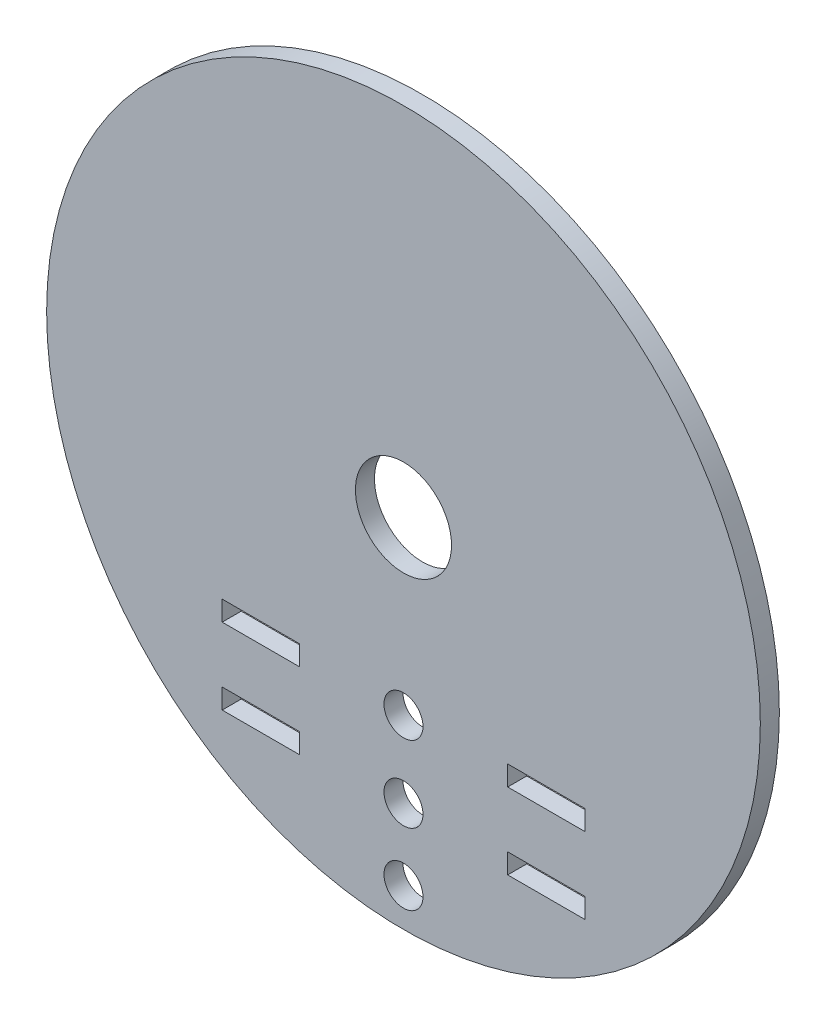
from build123d import *

# Parameters (mm, degrees)
SKETCH_1_R      = 37.5
SKETCH_1_R_2    = 2.05
SKETCH_1_R_3    = 5.05
SKETCH_1_W      = 8.1
SKETCH_1_H      = 2.1
EXTRUDE_1_DEPTH = 2


with BuildPart() as part:
    # 草图1 → 凸台-拉伸1 (new body)
    with BuildSketch(Plane.XY):
        with Locations((0, 26)):
            Circle(SKETCH_1_R)
        Circle(SKETCH_1_R_2, mode=Mode.SUBTRACT)
        with Locations((0, 8)):
            Circle(SKETCH_1_R_2, mode=Mode.SUBTRACT)
        with Locations((0, 26)):
            Circle(SKETCH_1_R_3, mode=Mode.SUBTRACT)
        with Locations((0, -7.5)):
            Circle(SKETCH_1_R_2, mode=Mode.SUBTRACT)
        with Locations((-15, 8)):
            Rectangle(SKETCH_1_W, SKETCH_1_H, mode=Mode.SUBTRACT)
        with Locations((-15, 0)):
            Rectangle(SKETCH_1_W, SKETCH_1_H, mode=Mode.SUBTRACT)
        with Locations((15, 8)):
            Rectangle(SKETCH_1_W, SKETCH_1_H, mode=Mode.SUBTRACT)
        with Locations((15, 0)):
            Rectangle(SKETCH_1_W, SKETCH_1_H, mode=Mode.SUBTRACT)
    extrude(amount=EXTRUDE_1_DEPTH)


solid = part.part
